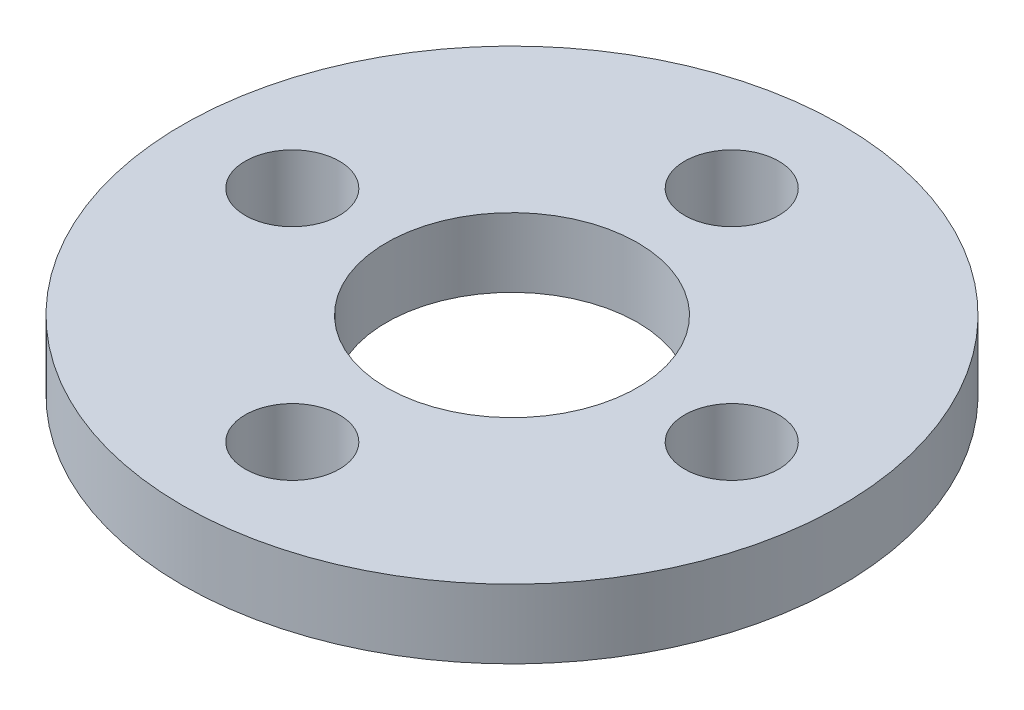
from build123d import *

# Parameters (mm, degrees)
SKETCH1_R           = 10.5
BOSS_EXTRUDE1_DEPTH = 2.2
SKETCH2_R           = 4
SKETCH2_R_2         = 1.5
CUT_EXTRUDE1_DEPTH  = 2.2


with BuildPart() as part:
    # Sketch1 → Boss-Extrude1 (new body)
    with BuildSketch(Plane(origin=(0, 0, 0), x_dir=(1, 0, 0), z_dir=(0, 1, 0))):
        with Locations(Location((0, 0, 0), (0, 0, 270))):
            Circle(SKETCH1_R)
    extrude(amount=BOSS_EXTRUDE1_DEPTH)

    # Sketch2 → Cut-Extrude1 (cut)
    with BuildSketch(Plane(origin=(0, 2.2, 0), x_dir=(1, 0, 0), z_dir=(0, 1, 0))):
        with Locations(Location((0, 0, 0), (0, 0, 270))):
            Circle(SKETCH2_R)
        with Locations(Location((0, 7, 0), (0, 0, 270))):
            Circle(SKETCH2_R_2)
        with Locations(Location((7, 0, 0), (0, 0, 270))):
            Circle(SKETCH2_R_2)
        with Locations(Location((0, -7, 0), (0, 0, 270))):
            Circle(SKETCH2_R_2)
        with Locations(Location((-7, 0, 0), (0, 0, 270))):
            Circle(SKETCH2_R_2)
    extrude(amount=-CUT_EXTRUDE1_DEPTH, mode=Mode.SUBTRACT)


solid = part.part
